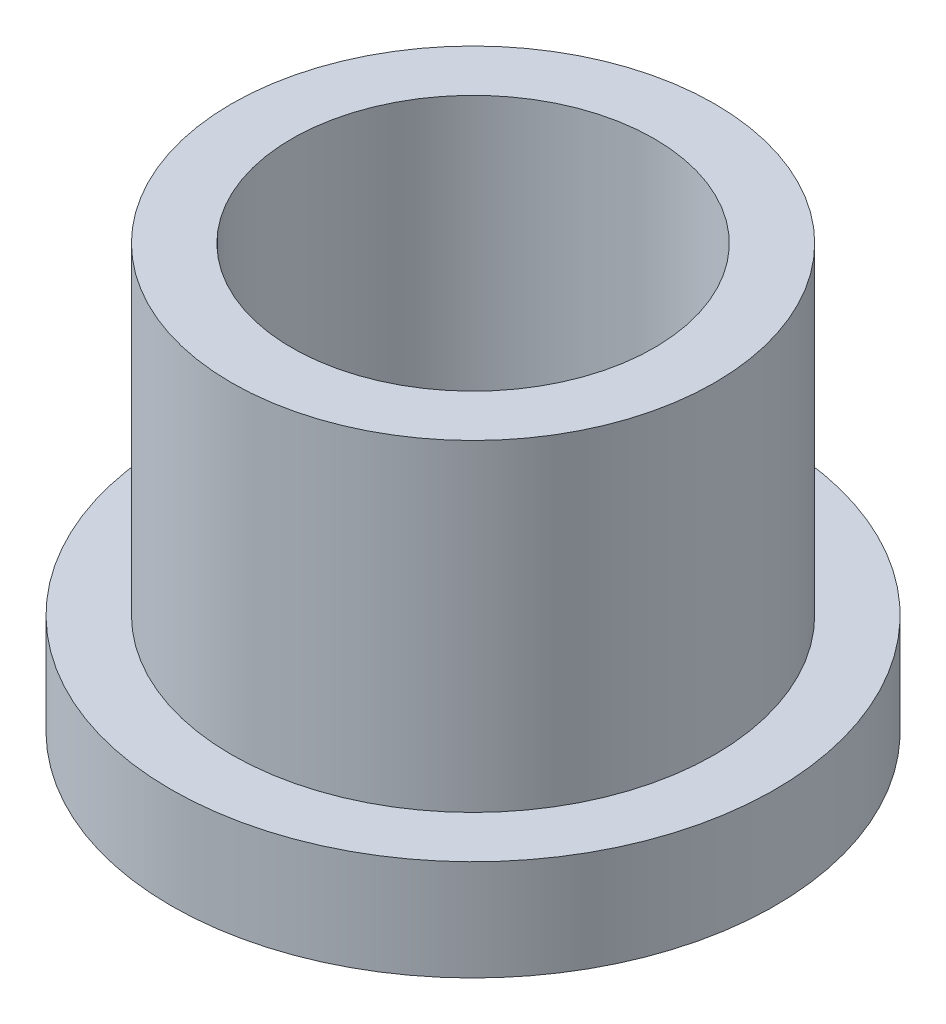
from build123d import *

# Parameters (mm, degrees)
SKETCH1_R           = 15
BOSS_EXTRUDE1_DEPTH = 5
SKETCH1_3_R         = 12
BOSS_EXTRUDE2_DEPTH = 21
SKETCH1_4_R         = 9
CUT_EXTRUDE1_DEPTH  = 30.849623113


with BuildPart() as part:
    # Sketch1 → Boss-Extrude1 (new body)
    with BuildSketch(Plane(origin=(0, 0, 0), x_dir=(1, 0, 0), z_dir=(0, 1, 0))):
        Circle(SKETCH1_R)
    extrude(amount=BOSS_EXTRUDE1_DEPTH)

    # Sketch1<3> → Boss-Extrude2 (add)
    with BuildSketch(Plane(origin=(0, 0, 0), x_dir=(1, 0, 0), z_dir=(0, 1, 0))):
        Circle(SKETCH1_3_R)
    extrude(amount=BOSS_EXTRUDE2_DEPTH)

    # Sketch1<4> → Cut-Extrude1 (cut, through all)
    with BuildSketch(Plane(origin=(0, 0, 0), x_dir=(1, 0, 0), z_dir=(0, 1, 0))):
        Circle(SKETCH1_4_R)
    extrude(amount=CUT_EXTRUDE1_DEPTH, mode=Mode.SUBTRACT)


solid = part.part
